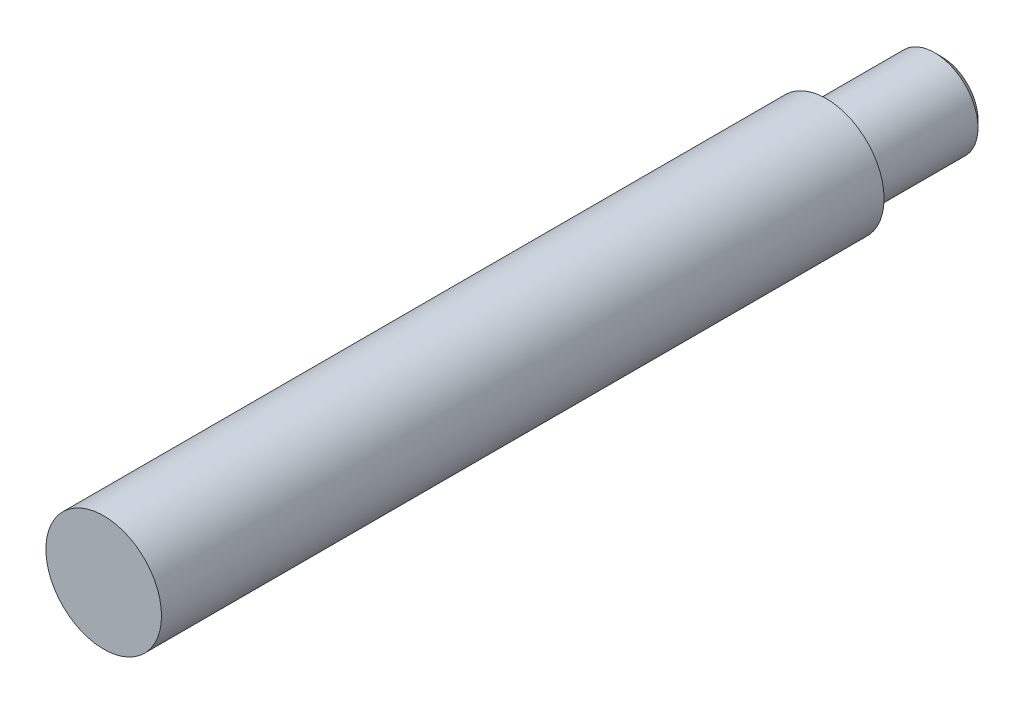
from build123d import *

# Parameters (mm, degrees)
ESQUISSE1_R        = 3
BOSS_EXTRU_1_DEPTH = 8
CHANFREIN1_SIZE    = 0.5
ESQUISSE2_R        = 4
BOSS_EXTRU_2_DEPTH = 50


with BuildPart() as part:
    # Esquisse1 → Boss.-Extru.1 (new body)
    with BuildSketch(Plane.XY):
        Circle(ESQUISSE1_R)
    extrude(amount=BOSS_EXTRU_1_DEPTH)

    # Chanfrein1
    chanfrein1_edges = [part.edges().sort_by_distance(p)[0] for p in [
        (-3, 0, 0),
    ]]
    chamfer(chanfrein1_edges, length=CHANFREIN1_SIZE)

    # Esquisse2 → Boss.-Extru.2 (add)
    with BuildSketch(Plane.XY.offset(8)):
        Circle(ESQUISSE2_R)
    extrude(amount=BOSS_EXTRU_2_DEPTH)


solid = part.part
